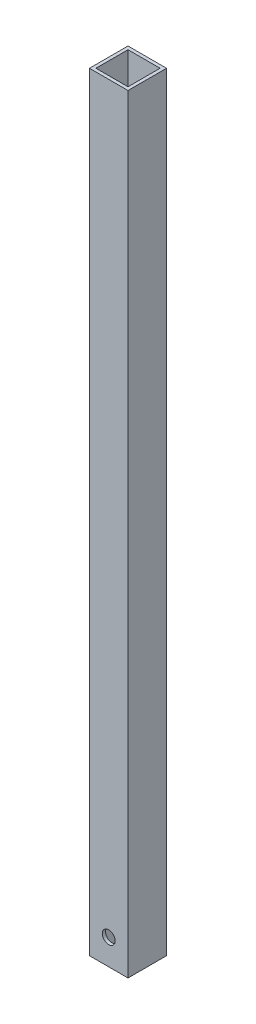
from build123d import *

# Parameters (mm, degrees)
SKETCH1_W           = 19.05
SKETCH1_H           = 19.05
SKETCH1_W_2         = 15.875
SKETCH1_H_2         = 15.875
BOSS_EXTRUDE1_DEPTH = 380
SKETCH2_R           = 3.175
CUT_EXTRUDE1_DEPTH  = 381.596411077


with BuildPart() as part:
    # Sketch1 → Boss-Extrude1 (new body)
    with BuildSketch(Plane(origin=(0, 0, 0), x_dir=(1, 0, 0), z_dir=(0, 1, 0))):
        Rectangle(SKETCH1_W, SKETCH1_H)
        Rectangle(SKETCH1_W_2, SKETCH1_H_2, mode=Mode.SUBTRACT)
    extrude(amount=BOSS_EXTRUDE1_DEPTH)

    # Sketch2 → Cut-Extrude1 (cut, through all)
    with BuildSketch(Plane.XY.offset(9.525)):
        with Locations((0, 12.7)):
            Circle(SKETCH2_R)
    extrude(amount=-CUT_EXTRUDE1_DEPTH, mode=Mode.SUBTRACT)


solid = part.part
